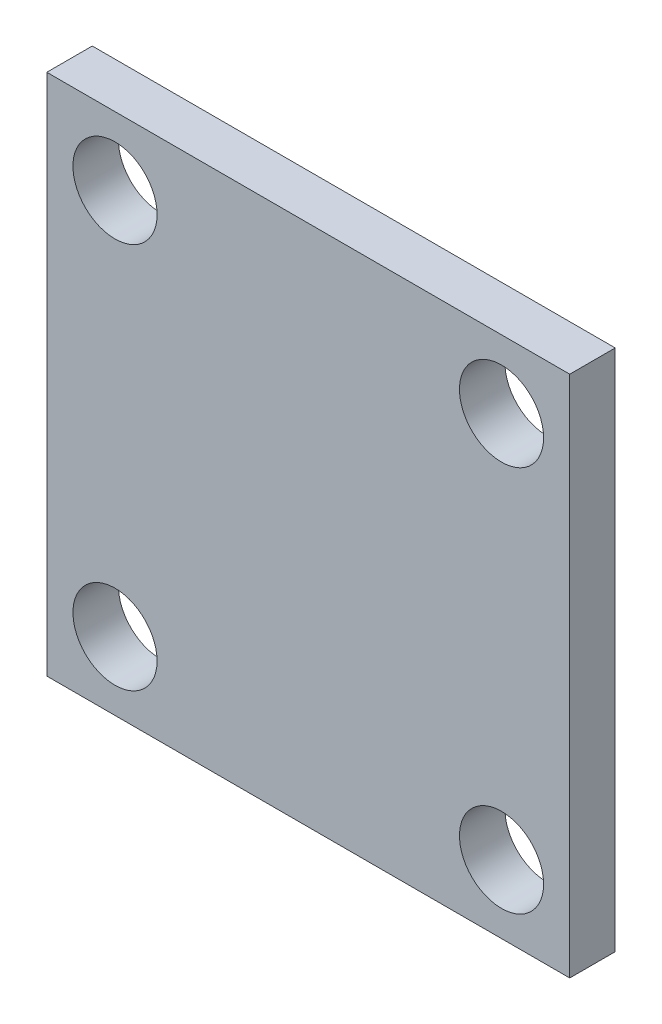
from build123d import *

# Parameters (mm, degrees)
SKETCH1_W           = 23
SKETCH1_H           = 23
SKETCH1_R           = 1.85
BOSS_EXTRUDE1_DEPTH = 2


with BuildPart() as part:
    # Sketch1 → Boss-Extrude1 (new body)
    with BuildSketch(Plane.XY):
        Rectangle(SKETCH1_W, SKETCH1_H)
        with Locations((-8.5, 8.5)):
            Circle(SKETCH1_R, mode=Mode.SUBTRACT)
        with Locations((8.5, 8.5)):
            Circle(SKETCH1_R, mode=Mode.SUBTRACT)
        with Locations((8.5, -8.5)):
            Circle(SKETCH1_R, mode=Mode.SUBTRACT)
        with Locations((-8.5, -8.5)):
            Circle(SKETCH1_R, mode=Mode.SUBTRACT)
    extrude(amount=BOSS_EXTRUDE1_DEPTH)


solid = part.part
